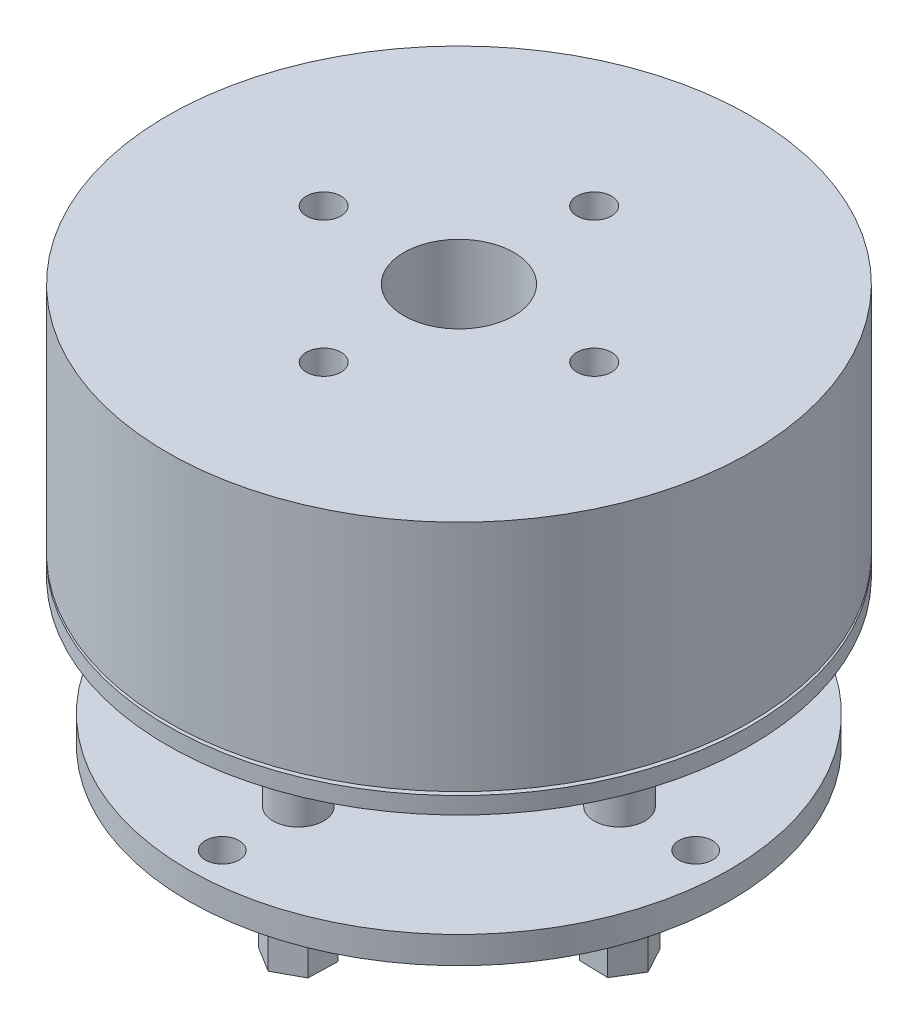
from build123d import *

# Parameters (mm, degrees)
SKETCH_1_W               = 17.25
SKETCH_1_H               = 15
SKETCH_2_W               = 13.75
SKETCH_2_H               = 0.2
CUT_EXTRUDE_1_REACH      = 30.638
SKETCH_3_R               = 3.25
PATTERN_CIRCULAR_1_COUNT = 4
SKETCH_8_R               = 1.5
EXTRUDE_1_DEPTH          = 7
SKETCH_9_R               = 16
EXTRUDE_2_DEPTH          = 1.6
EXTRUDE_3_DEPTH          = 6
CUT_EXTRUDE_2_DEPTH      = 34.942377642
CUT_EXTRUDE_2_DEPTH_BACK = 1.6
SKETCH_12_R              = 1
SKETCH_14_W              = 2.75
SKETCH_14_H              = 4.5


with BuildPart() as part:
    # 草图1 → 旋转2 (revolve)
    with BuildSketch(Plane.XY, mode=Mode.PRIVATE) as revolve_2_sk:
        with Locations((8.625, 7.5)):
            Rectangle(SKETCH_1_W, SKETCH_1_H)
    revolve(revolve_2_sk.sketch.rotate(Axis((0, 0, 0), (0, 1, 0)), 90), axis=Axis((0, 0, 0), (0, 1, 0)))

    # 草图2 → 切除-旋转2 (revolve, cut)
    with BuildSketch(Plane.XY, mode=Mode.PRIVATE) as cut_revolve_2_sk:
        with Locations((-10.375, 1.1)):
            Rectangle(SKETCH_2_W, SKETCH_2_H)
    revolve(cut_revolve_2_sk.sketch.rotate(Axis((0, 0, 0), (0, 1, 0)), 270), axis=Axis((0, 0, 0), (0, 1, 0)), mode=Mode.SUBTRACT)

    # 草图3 → 切除-拉伸1 (cut, up to next)
    with BuildSketch(Plane(origin=(0, 15, 0), x_dir=(1, 0, 0), z_dir=(0, 1, 0)), mode=Mode.PRIVATE) as cut_extrude_1_sk1:
        with Locations(Location((0, 0, 0), (0, 0, 270))):
            Circle(SKETCH_3_R)
    cut_extrude_1_tool1 = extrude(cut_extrude_1_sk1.sketch, amount=-CUT_EXTRUDE_1_REACH, mode=Mode.PRIVATE) & part.part
    add(cut_extrude_1_tool1.solids().sort_by_distance((0, 15, 0))[0], mode=Mode.SUBTRACT)

    # 草图6 → M2.5 螺纹孔1 (revolve, cut)
    with BuildSketch(Plane(origin=(0, 15, -8), x_dir=(0, 0, 1), z_dir=(1, 0, 0))):
        Polygon((0, 0), (0, 3.615882135), (1.025, 3), (1.025, 0), align=None)
    hole_wizard_m2_5_1 = revolve(axis=Axis((0, 21.35, -8), (0, -1, 0)), mode=Mode.SUBTRACT)

    # 阵列(圆周)1: M2.5 螺纹孔1 ×4 about axis
    pattern_circular_1_axis = Axis((0, 0, 0), (0, 1, 0))
    for i in range(1, PATTERN_CIRCULAR_1_COUNT):
        add(hole_wizard_m2_5_1.rotate(pattern_circular_1_axis, i * 360 / PATTERN_CIRCULAR_1_COUNT), mode=Mode.SUBTRACT)

    # 草图8 → 凸台-拉伸1 (add)
    with BuildSketch(Plane.XZ):
        with Locations(Location((0, 9.5, 0), (0, 0, 270))):
            Circle(SKETCH_8_R)
        with Locations(Location((9.5, 0, 0), (0, 0, 270))):
            Circle(SKETCH_8_R)
        with Locations(Location((0, -9.5, 0), (0, 0, 270))):
            Circle(SKETCH_8_R)
        with Locations(Location((-9.5, 0, 0), (0, 0, 270))):
            Circle(SKETCH_8_R)
    extrude(amount=EXTRUDE_1_DEPTH)

    # 草图14 → 旋转3 (revolve)
    with BuildSketch(Plane.XY, mode=Mode.PRIVATE) as revolve_3_sk:
        with Locations((4.625, -2.25)):
            Rectangle(SKETCH_14_W, SKETCH_14_H)
    revolve(revolve_3_sk.sketch.rotate(Axis((0, 0, 0), (0, -1, 0)), 90), axis=Axis((0, 0, 0), (0, -1, 0)))


with BuildPart() as body_2:
    # 草图9 → 凸台-拉伸2 (new body)
    with BuildSketch(Plane(origin=(0, -7, 0), x_dir=(-1, 0, 0), z_dir=(0, -1, 0))):
        with Locations(Location((0, 0, 0), (0, 0, 90))):
            Circle(SKETCH_9_R)
    extrude(amount=EXTRUDE_2_DEPTH)

    # 草图11 → 凸台-拉伸3 (add)
    with BuildSketch(Plane.XZ.offset(8.6)):
        Polygon((8.676777179, -1.52391082), (10.408134073, -1.474887286), (11.231356894, 0.049023534), (10.323222821, 1.52391082), (8.591865927, 1.474887286), (7.768643106, -0.049023534), align=None)
        Polygon((1.52391082, 8.676777179), (1.474887286, 10.408134073), (-0.049023534, 11.231356894), (-1.52391082, 10.323222821), (-1.474887286, 8.591865927), (0.049023534, 7.768643106), align=None)
        Polygon((-1.52391082, -8.676777179), (-1.474887286, -10.408134073), (0.049023534, -11.231356894), (1.52391082, -10.323222821), (1.474887286, -8.591865927), (-0.049023534, -7.768643106), align=None)
        Polygon((-8.676777179, 1.52391082), (-10.408134073, 1.474887286), (-11.231356894, -0.049023534), (-10.323222821, -1.52391082), (-8.591865927, -1.474887286), (-7.768643106, 0.049023534), align=None)
    extrude(amount=EXTRUDE_3_DEPTH)

    # 草图12 → 切除-拉伸2 (cut, two sides: drawn at the far end of the back side and taken through both)
    with BuildSketch(Plane.XZ.offset(8.6).offset(-CUT_EXTRUDE_2_DEPTH_BACK)):
        with Locations(Location((0, 14, 0), (0, 0, 270))):
            Circle(SKETCH_12_R)
        with Locations(Location((14, 0, 0), (0, 0, 270))):
            Circle(SKETCH_12_R)
        with Locations(Location((0, -14, 0), (0, 0, 270))):
            Circle(SKETCH_12_R)
        with Locations(Location((-14, 0, 0), (0, 0, 270))):
            Circle(SKETCH_12_R)
    extrude(amount=CUT_EXTRUDE_2_DEPTH + CUT_EXTRUDE_2_DEPTH_BACK, mode=Mode.SUBTRACT)


solid = Compound([part.part, body_2.part])
